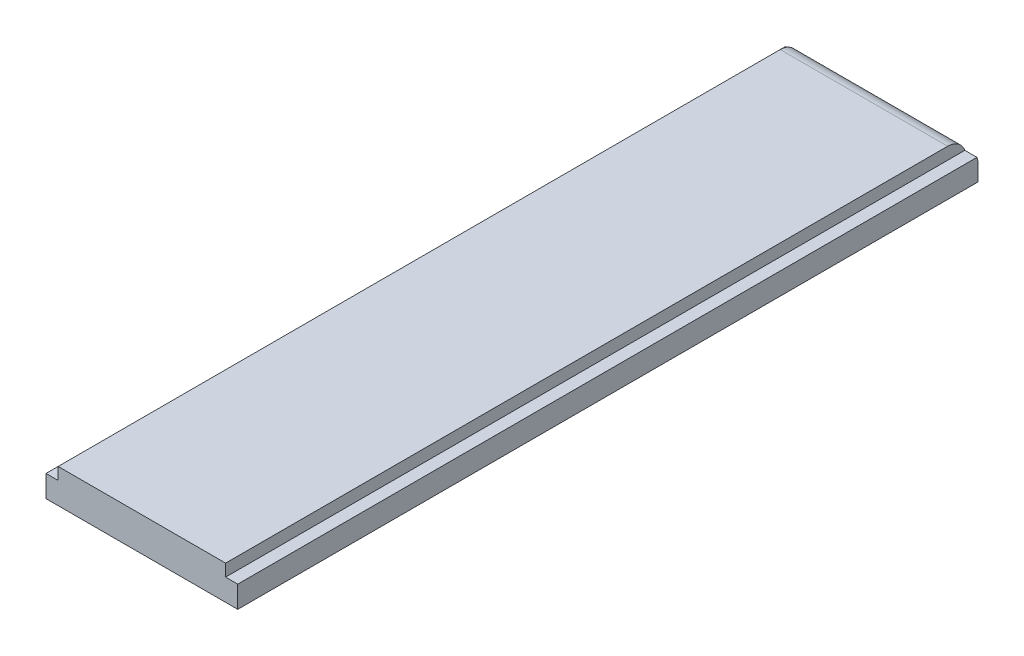
from build123d import *

# Parameters (mm, degrees)
ESQUISSE1_W             = 15.8
ESQUISSE1_H             = 62
BOSS_EXTRU_1_DEPTH      = 1.8
ESQUISSE2_W             = 13.8
ESQUISSE2_H             = 61
BOSS_EXTRU_2_DEPTH      = 1
CONG_1_R                = 1.5
ESQUISSE3_W             = 15.8
ESQUISSE3_H             = 1
ENL_V_MAT_EXTRU_1_DEPTH = 10


with BuildPart() as part:
    # Esquisse1 → Boss.-Extru.1 (new body)
    with BuildSketch(Plane(origin=(0, 0, 0), x_dir=(1, 0, 0), z_dir=(0, 1, 0))):
        with Locations((7.9, 31)):
            Rectangle(ESQUISSE1_W, ESQUISSE1_H)
    extrude(amount=BOSS_EXTRU_1_DEPTH)

    # Esquisse2 → Boss.-Extru.2 (add)
    with BuildSketch(Plane(origin=(0, 1.8, 0), x_dir=(1, 0, 0), z_dir=(0, 1, 0))):
        with Locations((7.9, 31.5)):
            Rectangle(ESQUISSE2_W, ESQUISSE2_H)
    extrude(amount=BOSS_EXTRU_2_DEPTH)

    # Congé1
    cong_1_edges = [part.edges().sort_by_distance(p)[0] for p in [
        (7.9, 2.8, -62),
    ]]
    fillet(cong_1_edges, radius=CONG_1_R)

    # Esquisse3 → Enlèv. mat.-Extru.1 (cut)
    with BuildSketch(Plane(origin=(0, 2.8, 0), x_dir=(1, 0, 0), z_dir=(0, 1, 0))):
        with Locations((7.9, 0.5)):
            Rectangle(ESQUISSE3_W, ESQUISSE3_H)
    extrude(amount=-ENL_V_MAT_EXTRU_1_DEPTH, mode=Mode.SUBTRACT)


solid = part.part
